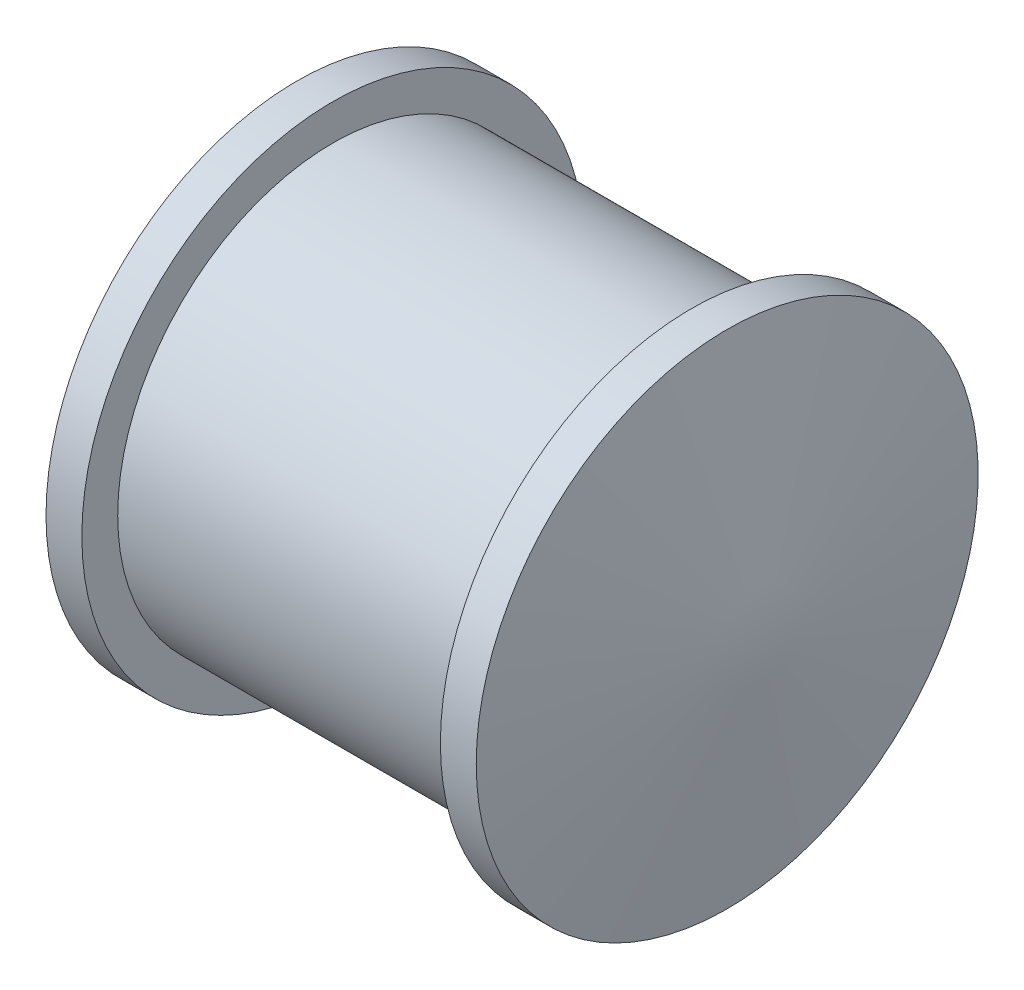
from build123d import *

# Parameters (mm, degrees)
SKETCH_1_W = 2.5
SKETCH_1_H = 3


with BuildPart() as part:
    # 草图1 → 旋转1 (revolve)
    with BuildSketch(Plane.XY, mode=Mode.PRIVATE) as revolve_1_sk:
        with Locations((1.25, 1.5)):
            Rectangle(SKETCH_1_W, SKETCH_1_H)
        Polygon((3, 0), (3, 3.5), (2.5, 3.5), (2.5, 3), (2.5, 0), align=None)
        Polygon((3.5, 0), (3, 0), (3, 3.5), align=None)
    revolve_1 = revolve(revolve_1_sk.sketch.rotate(Axis((0, 0, 0), (1, 0, 0)), 90), axis=Axis((0, 0, 0), (1, 0, 0)))

    # 镜向1: 旋转1 across plane
    add(revolve_1.mirror(Plane.ZY))


solid = part.part
